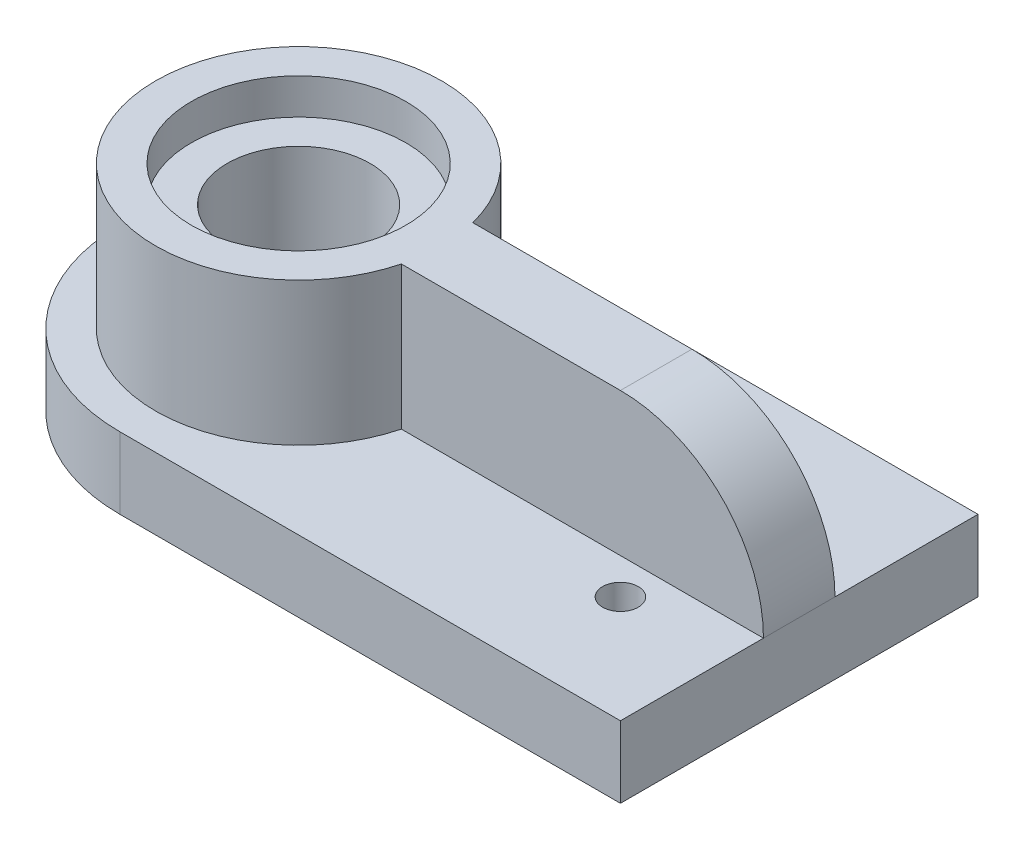
from build123d import *

# Parameters (mm, degrees)
SKETCH10_R          = 2.5
BOSS_EXTRUDE3_DEPTH = 10
SKETCH10_3_R        = 15
SKETCH10_3_R_2      = 10
BOSS_EXTRUDE4_DEPTH = 30
FILLET1_RADIUS      = 25
FILLET1_LENGTH      = 10
FILLET2_R           = 20
CUT_EXTRUDE1_START  = 25
SKETCH10_6_R        = 15
SKETCH10_6_R_2      = 10
CUT_EXTRUDE1_DEPTH  = 5


with BuildPart() as part:
    # Sketch10 → Boss-Extrude3 (new body)
    with BuildSketch(Plane(origin=(0, 0, 0), x_dir=(1, 0, 0), z_dir=(0, 1, 0))):
        with BuildLine():
            ThreePointArc((44.364916731, 20), (5, 25), (44.364916731, 30))
            Line((44.364916731, 30), (95, 30))
            Line((95, 30), (95, 50))
            Line((95, 50), (0, 50))
            Line((0, 50), (0, 0))
            Line((0, 0), (95, 0))
            Line((95, 0), (95, 20))
            Line((95, 20), (44.364916731, 20))
        make_face()
        with Locations(Location((80, 15, 0), (0, 0, 270))):
            Circle(SKETCH10_R, mode=Mode.SUBTRACT)
        with Locations(Location((80, 35, 0), (0, 0, 270))):
            Circle(SKETCH10_R, mode=Mode.SUBTRACT)
    extrude(amount=BOSS_EXTRUDE3_DEPTH)

    # Sketch10<3> → Boss-Extrude4 (add)
    # profile 1 of 2: a face of its own
    with BuildSketch(Plane(origin=(0, 0, 0), x_dir=(1, 0, 0), z_dir=(0, 1, 0))):
        with BuildLine():
            Line((95, 30), (44.364916731, 30))
            ThreePointArc((44.364916731, 30), (5, 25), (44.364916731, 20))
            Line((44.364916731, 20), (95, 20))
            Line((95, 20), (95, 30))
        make_face()
        with Locations((25, 25)):
            Circle(SKETCH10_3_R, mode=Mode.SUBTRACT)
    # profile 2 of 2: a face of its own
    with BuildSketch(Plane(origin=(0, 0, 0), x_dir=(1, 0, 0), z_dir=(0, 1, 0))):
        with Locations((25, 25)):
            Circle(SKETCH10_3_R)
        with Locations(Location((25, 25, 0), (0, 0, 270))):
            Circle(SKETCH10_3_R_2, mode=Mode.SUBTRACT)
    extrude(amount=BOSS_EXTRUDE4_DEPTH)

    # Fillet1: full round fillet: the end face becomes a half cylinder, R = half its width
    fillet1_face = Plane((0, 5, -25), x_dir=(0, 1, 0), z_dir=(-1, 0, 0))  # on the end face: x along it, z out of the body
    fillet1_slab = fillet1_face.offset(-FILLET1_RADIUS / 2) * Box(FILLET1_LENGTH, 2 * FILLET1_RADIUS, FILLET1_RADIUS, mode=Mode.PRIVATE)  # the body's end, R deep
    fillet1_round = Plane((25, 5, -25), x_dir=(-1, 0, 0), z_dir=(0, 1, 0)) * Cylinder(FILLET1_RADIUS, FILLET1_LENGTH, mode=Mode.PRIVATE)  # its axis R under the face
    add(fillet1_slab - fillet1_round, mode=Mode.SUBTRACT)

    # Fillet2
    fillet2_edges = [part.edges().sort_by_distance(p)[0] for p in [
        (95, 30, -25),
    ]]
    fillet(fillet2_edges, radius=FILLET2_R)

    # Sketch10<6> → Cut-Extrude1 (cut)
    with BuildSketch(Plane(origin=(0, 0, 0), x_dir=(1, 0, 0), z_dir=(0, 1, 0)).offset(CUT_EXTRUDE1_START)):
        with Locations(Location((25, 25, 0), (0, 0, 270))):
            Circle(SKETCH10_6_R)
        with Locations(Location((25, 25, 0), (0, 0, 270))):
            Circle(SKETCH10_6_R_2, mode=Mode.SUBTRACT)
    extrude(amount=CUT_EXTRUDE1_DEPTH, mode=Mode.SUBTRACT)


solid = part.part
